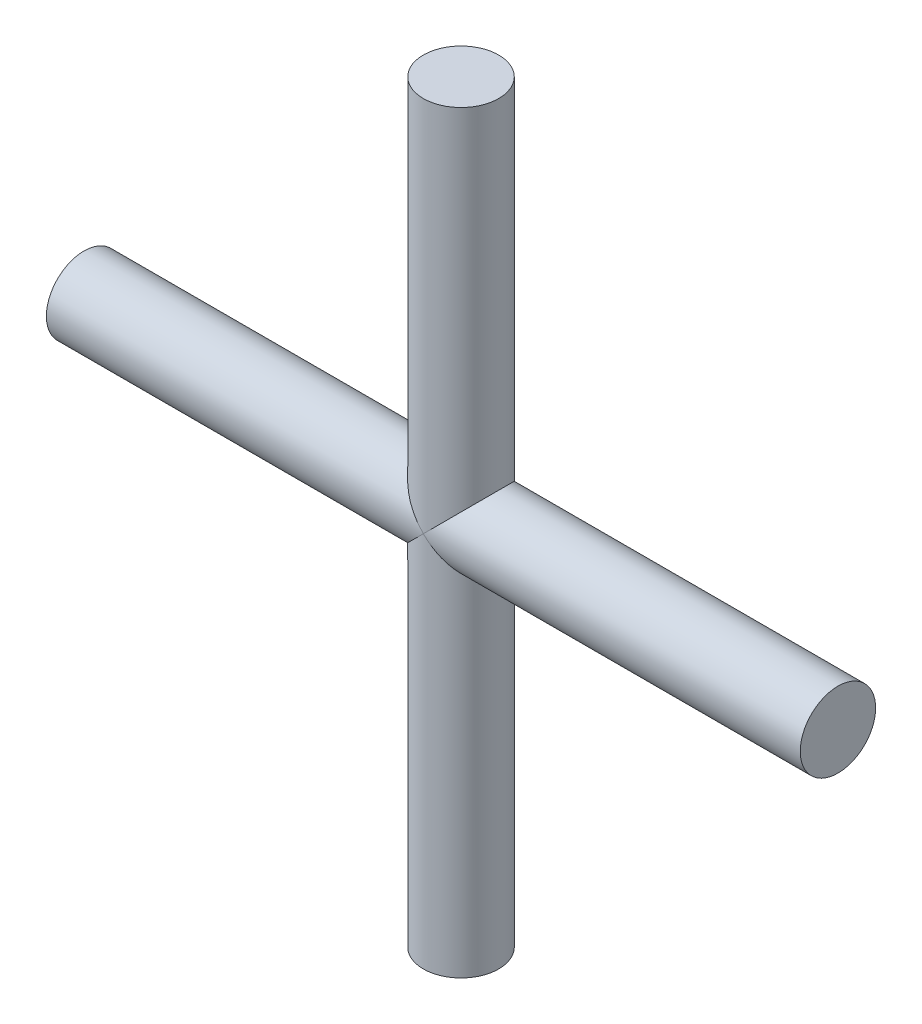
from build123d import *

# Parameters (mm, degrees)
SKETCH1_R           = 0.75
BOSS_EXTRUDE1_DEPTH = 15
SKETCH3_R           = 0.75
BOSS_EXTRUDE2_DEPTH = 15


with BuildPart() as part:
    # Sketch1 → Boss-Extrude1 (new body)
    with BuildSketch(Plane(origin=(0, 0, 0), x_dir=(1, 0, 0), z_dir=(0, 1, 0))):
        with Locations(Location((0, 0, 0), (0, 0, 270))):
            Circle(SKETCH1_R)
    extrude(amount=BOSS_EXTRUDE1_DEPTH)

    # Sketch3 → Boss-Extrude2 (add)
    with BuildSketch(Plane(origin=(-7.5, 7.5, 0), x_dir=(0, 0, -1), z_dir=(1, 0, 0))):
        with Locations(Location((0, 0, 0), (0, 0, 180))):
            Circle(SKETCH3_R)
    extrude(amount=BOSS_EXTRUDE2_DEPTH)


solid = part.part
